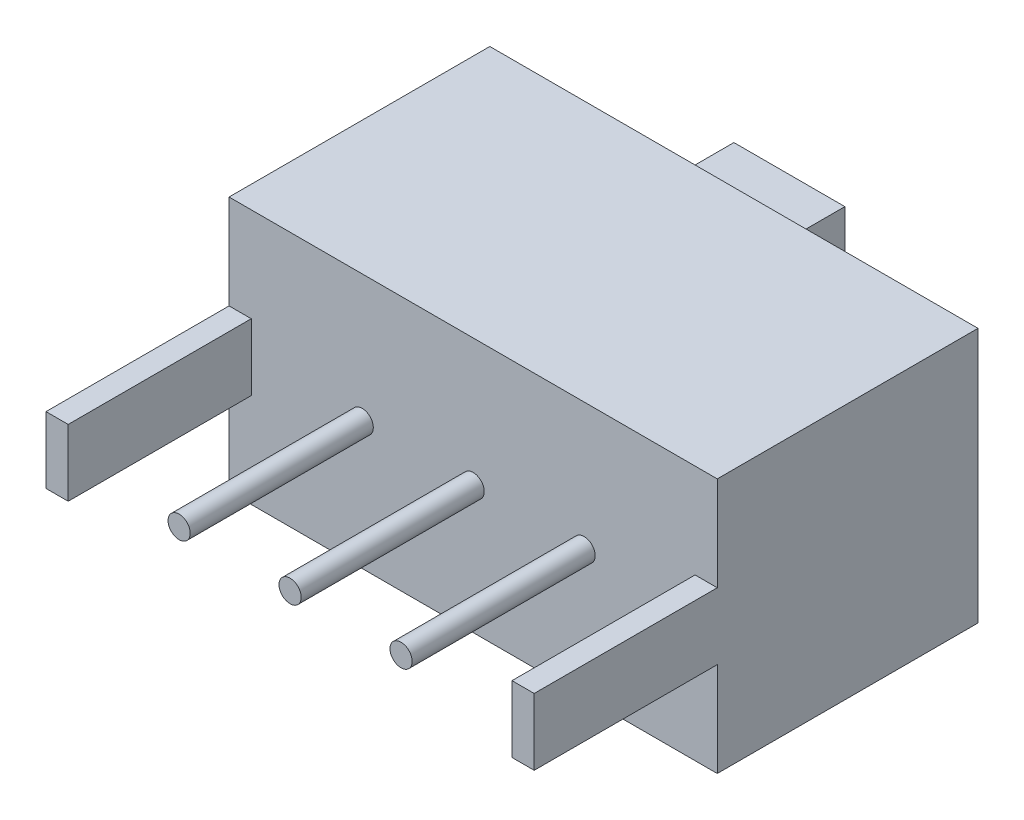
from build123d import *

# Parameters (mm, degrees)
SKETCH_1_W          = 8.8
SKETCH_1_H          = 4.6
EXTRUDE_1_DEPTH     = 4.7
SKETCH_1_3_W        = 4.2
SKETCH_1_3_H        = 2.2
SKETCH_1_3_W_2      = 2
SKETCH_1_3_H_2      = 2
CUT_EXTRUDE_1_DEPTH = 0.2
SKETCH_1_4_W        = 2
SKETCH_1_4_H        = 2
EXTRUDE_2_DEPTH     = 2
SKETCH_2_R          = 0.2
SKETCH_2_W          = 0.4
SKETCH_2_H          = 1.2
EXTRUDE_3_DEPTH     = 3.3


with BuildPart() as part:
    # 草图1 → 凸台-拉伸1 (new body)
    with BuildSketch(Plane.XY):
        with Locations((4.4, -2.3)):
            Rectangle(SKETCH_1_W, SKETCH_1_H)
    extrude(amount=EXTRUDE_1_DEPTH)

    # 草图1<3> → 切除-拉伸1 (cut)
    with BuildSketch(Plane.XY):
        with Locations((4.4, -2.3)):
            Rectangle(SKETCH_1_3_W, SKETCH_1_3_H)
        with Locations((3.4, -2.3)):
            Rectangle(SKETCH_1_3_W_2, SKETCH_1_3_H_2, mode=Mode.SUBTRACT)
    extrude(amount=CUT_EXTRUDE_1_DEPTH, mode=Mode.SUBTRACT)

    # 草图1<4> → 凸台-拉伸2 (add)
    with BuildSketch(Plane.XY):
        with Locations((3.4, -2.3)):
            Rectangle(SKETCH_1_4_W, SKETCH_1_4_H)
    extrude(amount=-EXTRUDE_2_DEPTH)

    # 草图2 → 凸台-拉伸3 (add)
    with BuildSketch(Plane.XY.offset(4.7)):
        with Locations((2.4, -2.3)):
            Circle(SKETCH_2_R)
        with Locations((4.4, -2.3)):
            Circle(SKETCH_2_R)
        with Locations((6.4, -2.3)):
            Circle(SKETCH_2_R)
        with Locations((8.6, -2.3)):
            Rectangle(SKETCH_2_W, SKETCH_2_H)
        with Locations((0.2, -2.3)):
            Rectangle(SKETCH_2_W, SKETCH_2_H)
    extrude(amount=EXTRUDE_3_DEPTH)


solid = part.part
